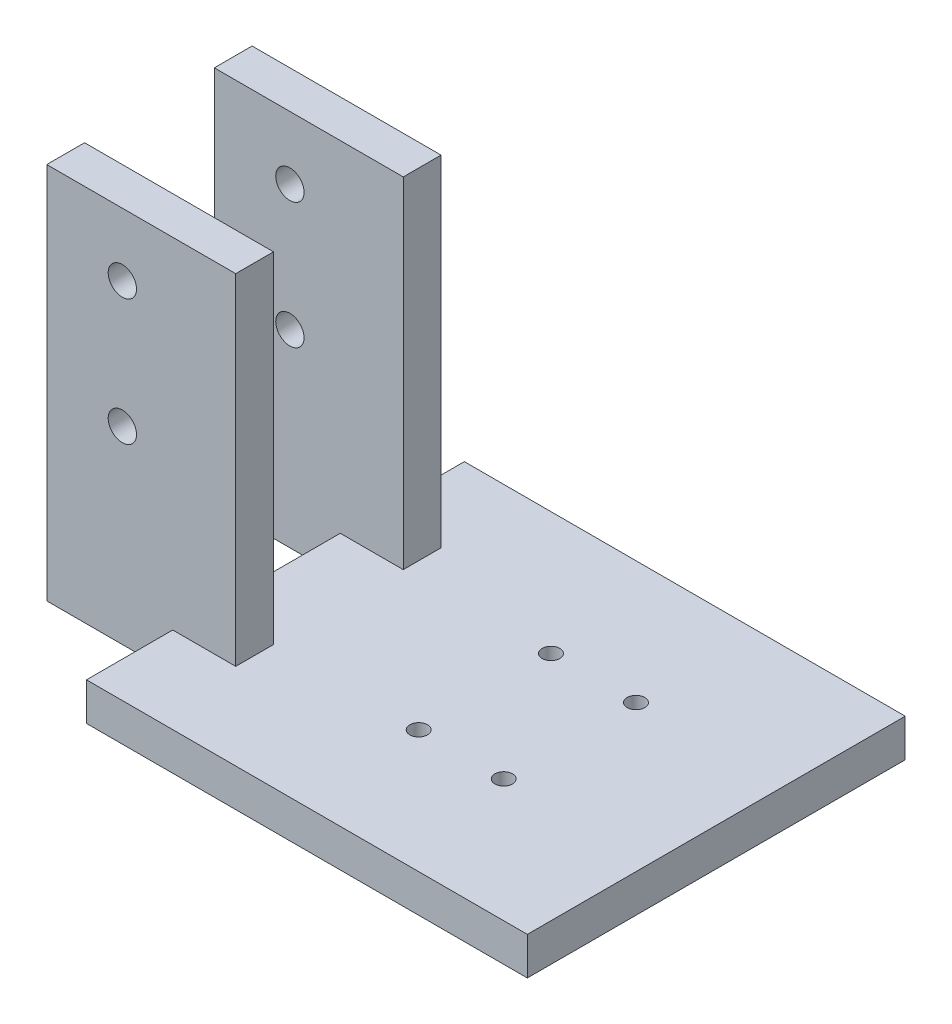
from build123d import *

# Parameters (mm, degrees)
EXTRUDE_START             = -30
SKETCH_1_W                = 70
SKETCH_1_H                = 6
EXTRUDE_250_DEPTH         = 60
EXTRUDE_START_2           = -16.3
SKETCH_2_W                = 30
SKETCH_2_H                = 60
EXTRUDE_16_3_DEPTH        = 6
EXTRUDE_START_3           = 10.3
SKETCH_3_W                = 30
SKETCH_3_H                = 60
EXTRUDE_10_3_DEPTH        = 6
CUT_EXTRUDE_M4_DEPTH      = 103.95630141
CUT_EXTRUDE_M4_DEPTH_BACK = 103.95630141
SKETCH_4_R                = 2.25
F_6MM_START               = -46
SKETCH_5_R                = 2.7
F_6MM_DEPTH               = 6
F_21X13P5_DEPTH           = 106.432442825
F_21X13P5_DEPTH_BACK      = 106.432442825
SKETCH_6_R                = 1.4


with BuildPart() as part:
    # 草图1 → Extrude 250 (new body)
    with BuildSketch(Plane.XY.offset(EXTRUDE_START)):
        with Locations((55, -37)):
            Rectangle(SKETCH_1_W, SKETCH_1_H)
    extrude(amount=EXTRUDE_250_DEPTH)

    # 草图2 → 夹臂侧板-16.3 (add)
    with BuildSketch(Plane.XY.offset(EXTRUDE_START_2)):
        with Locations((15, -10)):
            Rectangle(SKETCH_2_W, SKETCH_2_H)
    extrude(amount=EXTRUDE_16_3_DEPTH)

    # 草图3 → 夹臂侧板10.3 (add)
    with BuildSketch(Plane.XY.offset(EXTRUDE_START_3)):
        with Locations((15, -10)):
            Rectangle(SKETCH_3_W, SKETCH_3_H)
    extrude(amount=EXTRUDE_10_3_DEPTH)

    # 草图4 → 夹臂M4通孔 (cut, two sides: drawn at the far end of the back side and taken through both)
    with BuildSketch(Plane.XY.offset(-CUT_EXTRUDE_M4_DEPTH_BACK)):
        with Locations(Location((12, -10, 0), (0, 0, 180))):
            Circle(SKETCH_4_R)
        with Locations(Location((12, 10, 0), (0, 0, 180))):
            Circle(SKETCH_4_R)
    extrude(amount=CUT_EXTRUDE_M4_DEPTH + CUT_EXTRUDE_M4_DEPTH_BACK, mode=Mode.SUBTRACT)

    # 草图5 → 相机6mm绝缘支柱 (add)
    with BuildSketch(Plane(origin=(0, 0, 0), x_dir=(1, 0, 0), z_dir=(0, 1, 0)).offset(F_6MM_START)):
        with Locations(Location((53.25, -10.5, 0), (0, 0, 270))):
            Circle(SKETCH_5_R)
        with Locations(Location((53.25, 10.5, 0), (0, 0, 270))):
            Circle(SKETCH_5_R)
        with Locations(Location((66.75, -10.5, 0), (0, 0, 270))):
            Circle(SKETCH_5_R)
        with Locations(Location((66.75, 10.5, 0), (0, 0, 270))):
            Circle(SKETCH_5_R)
    extrude(amount=F_6MM_DEPTH)

    # 草图6 → 21x13p5相机孔阵 (cut, two sides: drawn at the far end of the back side and taken through both)
    with BuildSketch(Plane(origin=(0, 0, 0), x_dir=(1, 0, 0), z_dir=(0, 1, 0)).offset(-F_21X13P5_DEPTH_BACK)):
        with Locations(Location((53.25, -10.5, 0), (0, 0, 270))):
            Circle(SKETCH_6_R)
        with Locations(Location((53.25, 10.5, 0), (0, 0, 270))):
            Circle(SKETCH_6_R)
        with Locations(Location((66.75, -10.5, 0), (0, 0, 270))):
            Circle(SKETCH_6_R)
        with Locations(Location((66.75, 10.5, 0), (0, 0, 270))):
            Circle(SKETCH_6_R)
    extrude(amount=F_21X13P5_DEPTH + F_21X13P5_DEPTH_BACK, mode=Mode.SUBTRACT)


solid = part.part
